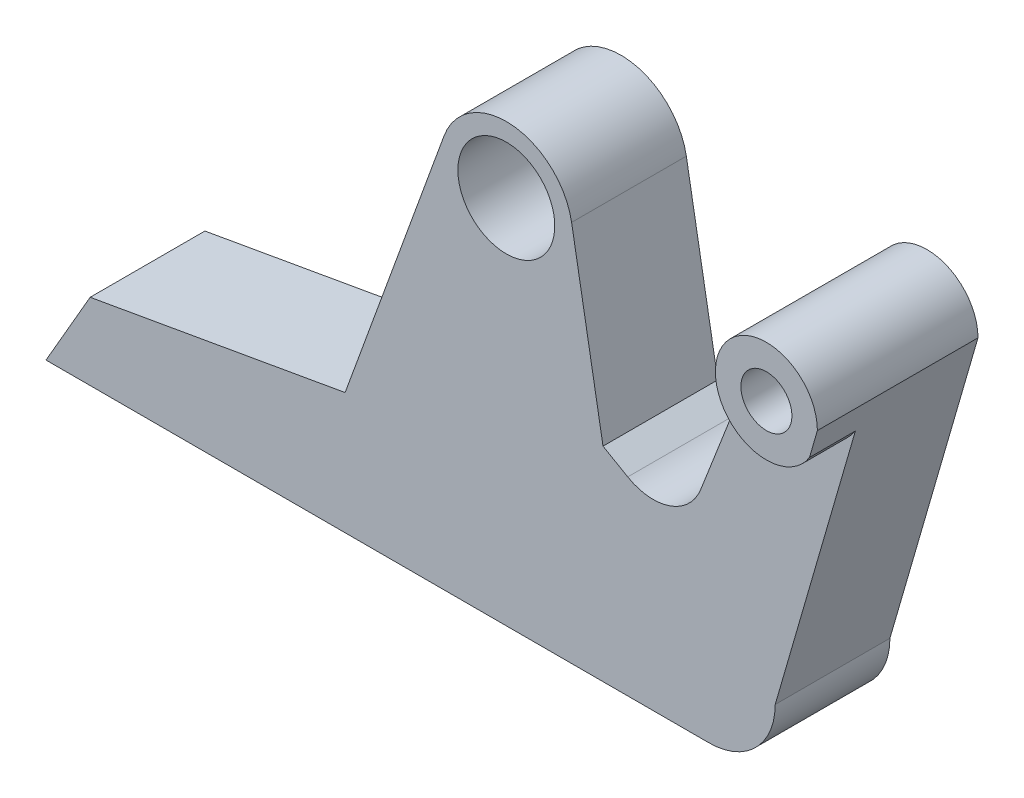
from build123d import *

# Parameters (mm, degrees)
SKETCH1_R           = 13
SKETCH1_R_2         = 9.5
SKETCH1_R_3         = 5
BOSS_EXTRUDE1_DEPTH = 22.5
SKETCH6_W           = 3
SKETCH6_H           = 3
CUT_EXTRUDE2_DEPTH  = 130
FILLET1_R           = 10
SKETCH7_R           = 5
BOSS_EXTRUDE2_DEPTH = 9


with BuildPart() as part:
    # Sketch1 → Boss-Extrude1 (new body)
    # profile 1 of 7: a face of its own
    with BuildSketch(Plane.XY):
        with BuildLine():
            ThreePointArc((103.274249999, 72.665631876), (88.01682369, 59.863131087), (78.058245929, 77.11189374))
            Line((78.058245929, 77.11189374), (58.660254038, 23.816349035))
            Line((58.660254038, 23.816349035), (8.660254038, 15))
            Line((8.660254038, 15), (0, 0))
            Line((0, 0), (130, 0))
            ThreePointArc((130, 0), (120.807611845, 3.807611845), (117, 13))
            ThreePointArc((117, 13), (117.888810571, 17.724308479), (120.433706247, 21.802614602))
            Line((120.433706247, 21.802614602), (124.168764572, 31.377772343))
            Line((124.168764572, 31.377772343), (109.234628196, 40))
            Line((109.234628196, 40), (103.076750789, 74.923058186))
            ThreePointArc((103.076750789, 74.923058186), (103.224781075, 73.798656532), (103.274249999, 72.665631876))
        make_face()
    # profile 2 of 7: a face of its own
    with BuildSketch(Plane.XY):
        with Locations((90.274249999, 72.665631876)):
            Circle(SKETCH1_R)
        with Locations(Location((90.274249999, 72.665631876, 0), (0, 0, 180))):
            Circle(SKETCH1_R_2, mode=Mode.SUBTRACT)
    # profile 3 of 7: a face of its own
    with BuildSketch(Plane.XY):
        with BuildLine():
            Line((136.5, 24.258330249), (124.168764572, 31.377772343))
            Line((124.168764572, 31.377772343), (120.433706247, 21.802614602))
            ThreePointArc((120.433706247, 21.802614602), (128.035776443, 25.850751955), (136.5, 24.258330249))
        make_face()
    # profile 4 of 7: a face of its own
    with BuildSketch(Plane.XY):
        with BuildLine():
            ThreePointArc((117, 13), (120.807611845, 3.807611845), (130, 0))
            ThreePointArc((130, 0), (139.192388155, 3.807611845), (143, 13))
            ThreePointArc((143, 13), (141.258330249, 19.5), (136.5, 24.258330249))
            ThreePointArc((136.5, 24.258330249), (128.035776443, 25.850751955), (120.433706247, 21.802614602))
            Line((120.433706247, 21.802614602), (117, 13))
        make_face()
    # profile 5 of 7: a face of its own
    with BuildSketch(Plane.XY):
        with BuildLine():
            Line((117, 13), (120.433706247, 21.802614602))
            ThreePointArc((120.433706247, 21.802614602), (117.888810571, 17.724308479), (117, 13))
        make_face()
    # profile 6 of 7: a face of its own
    with BuildSketch(Plane.XY):
        with BuildLine():
            Line((140.274249999, 72.665631876), (124.168764572, 31.377772343))
            Line((124.168764572, 31.377772343), (136.5, 24.258330249))
            ThreePointArc((136.5, 24.258330249), (141.258330249, 19.5), (143, 13))
            Line((143, 13), (158.72749128, 67.323093917))
            ThreePointArc((158.72749128, 67.323093917), (147.493280097, 63.060101886), (140.274249999, 72.665631876))
        make_face()
    # profile 7 of 7: a face of its own
    with BuildSketch(Plane.XY):
        with BuildLine():
            ThreePointArc((160.274249999, 72.665631876), (150.274249999, 82.665631876), (140.274249999, 72.665631876))
            ThreePointArc((140.274249999, 72.665631876), (147.493280097, 63.060101886), (158.72749128, 67.323093917))
            Line((158.72749128, 67.323093917), (160.274249999, 72.665631876))
        make_face()
        with Locations(Location((150.274249999, 72.665631876, 0), (0, 0, 180))):
            Circle(SKETCH1_R_3, mode=Mode.SUBTRACT)
    extrude(amount=BOSS_EXTRUDE1_DEPTH)

    # Sketch6 → Cut-Extrude2 (cut)
    with BuildSketch(Plane(origin=(0, 0, 0), x_dir=(0, 0, -1), z_dir=(-1, 0, 0))):
        with Locations((-9.75, -1.5)):
            Rectangle(SKETCH6_W, SKETCH6_H)
        Polygon((-8.25, -3), (-11.25, -3), (-11.25, -6), (-5.25, -6), (-5.25, -3), align=None)
        with Locations((-12.75, -1.5)):
            Rectangle(SKETCH6_W, SKETCH6_H)
        Polygon((-11.25, -3), (-14.25, -3), (-17.25, -3), (-17.25, -6), (-11.25, -6), align=None)
    extrude(amount=-CUT_EXTRUDE2_DEPTH, mode=Mode.SUBTRACT)

    # Fillet1
    fillet1_edges = [part.edges().sort_by_distance(p)[0] for p in [
        (124.168764572, 31.377772343, 11.25),
    ]]
    fillet(fillet1_edges, radius=FILLET1_R)

    # Sketch7 → Boss-Extrude2 (add)
    with BuildSketch(Plane.XY.offset(22.5)):
        with BuildLine():
            Line((158.72749128, 67.323093917), (160.274249999, 72.665631876))
            ThreePointArc((160.274249999, 72.665631876), (150.274249999, 82.665631876), (140.274249999, 72.665631876))
            ThreePointArc((140.274249999, 72.665631876), (147.493280097, 63.060101886), (158.72749128, 67.323093917))
        make_face()
        with Locations(Location((150.274249999, 72.665631876, 0), (0, 0, 180))):
            Circle(SKETCH7_R, mode=Mode.SUBTRACT)
    extrude(amount=BOSS_EXTRUDE2_DEPTH)


solid = part.part
